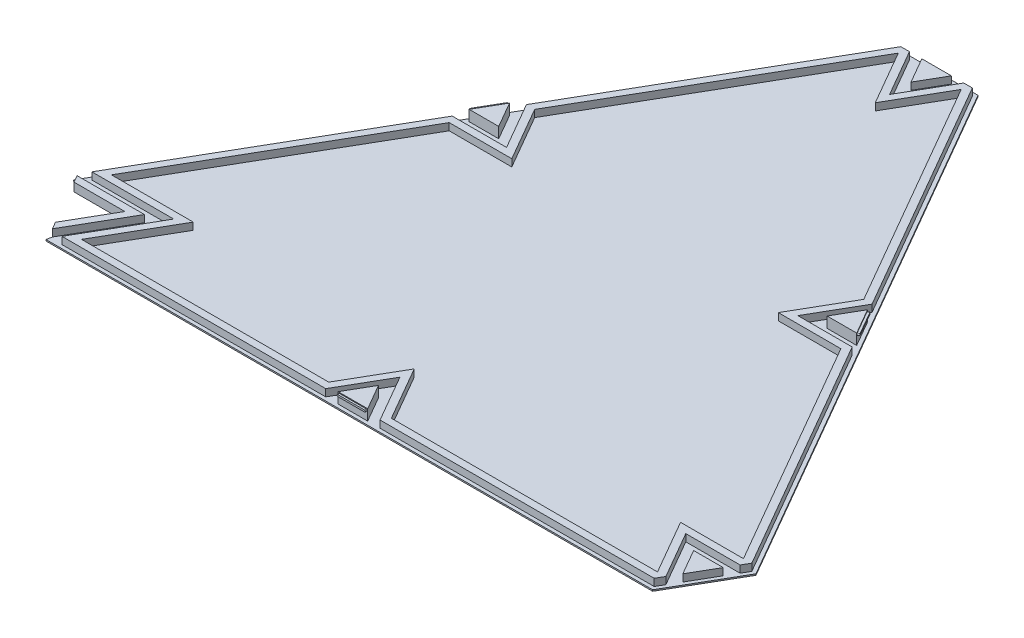
from build123d import *

# Parameters (mm, degrees)
BOSS_EXTRUDE1_DEPTH   = 2.38
BOSS_EXTRUDE1_2_DEPTH = 2.38
BOSS_EXTRUDE1_3_DEPTH = 2.38
BOSS_EXTRUDE1_4_DEPTH = 2.38
BOSS_EXTRUDE4_DEPTH   = 0.38
BOSS_EXTRUDE5_DEPTH   = 3.38
BOSS_EXTRUDE6_DEPTH   = 0.5
BOSS_EXTRUDE7_DEPTH   = 0.6
BOSS_EXTRUDE8_DEPTH   = 0.6


with BuildPart() as part:
    # Sketch1 → Boss-Extrude1 (new body)
    with BuildSketch(Plane(origin=(0, 0, 0), x_dir=(1, 0, 0), z_dir=(0, 1, 0))):
        Polygon((-85.720943795, 4.071796796), (-84.566243256, 2.071796795), (-75.143593538, 18.392304849), (-93.988892974, 18.392304849), (-92.834192436, 16.392304849), (-78.607695153, 16.392304849), align=None)
    extrude(amount=BOSS_EXTRUDE1_DEPTH)


with BuildPart() as body_2:
    # Sketch1 → Boss-Extrude1 2 (new body)
    with BuildSketch(Plane(origin=(0, 0, 0), x_dir=(1, 0, 0), z_dir=(0, 1, 0))):
        Polygon((91.344555444, 13.812177834), (83.076606252, 13.812177834), (87.210580853, 6.651923788), align=None)
    extrude(amount=BOSS_EXTRUDE1_2_DEPTH)


with BuildPart() as body_3:
    # Sketch1 → Boss-Extrude1 3 (new body)
    with BuildSketch(Plane(origin=(0, 0, 0), x_dir=(1, 0, 0), z_dir=(0, 1, 0))):
        Polygon((4.133974596, 164.865334799), (-4.133974596, 164.865334799), (0, 157.705080761), align=None)
    extrude(amount=BOSS_EXTRUDE1_3_DEPTH)


with BuildPart() as body_4:
    # Sketch1 → Boss-Extrude1 4 (new body)
    with BuildSketch(Plane(origin=(0, 0, 0), x_dir=(1, 0, 0), z_dir=(0, 1, 0))):
        Polygon((-92.834192436, 21.392304849), (-69.947441134, 21.392304849), (-81.390816785, 1.571796811), (-7.598076227, 1.571796811), (5.6e-08, 14.732050972), (7.598076338, 1.571796812), (84.27756817, 1.571796812), (85.478530104, 3.651923899), (77.880453952, 16.812177834), (93.076606256, 16.812177834), (94.277568143, 18.892304841), (55.937822181, 85.298692796), (40.741669759, 85.298692796), (48.33974597, 98.458946834), (10.000000007, 164.865334792), (7.598076211, 164.865334792), (0, 151.705080754), (-7.598076212, 164.865334792), (-9.999999977, 164.865334792), (-48.339745938, 98.458946839), (-40.741669726, 85.298692801), (-55.937822149, 85.298692801), align=None)
        Polygon((-8.752776823, 3.571796679), (-77.926715228, 3.571796679), (-66.4833395, 23.392304849), (-89.370090821, 23.392304849), (-54.783121611, 83.298692801), (-37.277568111, 83.298692801), (-46.030344861, 98.458946839), (-8.799038094, 162.945461791), (0, 147.705080754), (8.799038109, 162.945461817), (46.030344894, 98.458946834), (37.277568144, 83.298692796), (54.783121643, 83.298692796), (92.014428415, 18.812177834), (74.416352337, 18.812177834), (83.2153905, 3.571796679), (8.752776819, 3.571796679), (-2e-09, 18.73205084), align=None, mode=Mode.SUBTRACT)
    extrude(amount=BOSS_EXTRUDE1_4_DEPTH)


    add(body_2.part)  # Boss-Extrude4 merges body 2

    add(body_3.part)  # Boss-Extrude4 merges body 3
    # Sketch1<8> → Boss-Extrude4 (add)
    # profile 1 of 2: a face of its own
    with BuildSketch(Plane(origin=(0, 0, 0), x_dir=(1, 0, 0), z_dir=(0, 1, 0))):
        Polygon((-75.143593538, 18.392304849), (-84.566243256, 2.071796795), (-84.854918391, 0.571796796), (84.85491843, 0.571796796), (95.432268703, 18.892304753), (10.577350242, 165.865334799), (-10.577350242, 165.865334799), (-95.432268647, 18.892304849), (-93.988892974, 18.392304849), align=None)
        Polygon((4.133974507, 1.571796687), (-4.133974466, 1.571796687), (-1.08e-07, 8.732050756), align=None, mode=Mode.SUBTRACT)
        Polygon((87.210580853, 6.651923788), (83.076606252, 13.812177834), (91.344555444, 13.812177834), align=None, mode=Mode.SUBTRACT)
        Polygon((-45.937822149, 88.298692801), (-54.205771341, 88.298692801), (-50.071796745, 95.458946839), align=None, mode=Mode.SUBTRACT)
        Polygon((0, 157.705080761), (-4.133974596, 164.865334799), (4.133974596, 164.865334799), align=None, mode=Mode.SUBTRACT)
        Polygon((-81.390816785, 1.571796811), (-69.947441134, 21.392304849), (-92.834192436, 21.392304849), (-55.937822149, 85.298692801), (-40.741669726, 85.298692801), (-48.339745938, 98.458946839), (-9.999999977, 164.865334792), (-7.598076212, 164.865334792), (0, 151.705080754), (7.598076211, 164.865334792), (10.000000007, 164.865334792), (48.33974597, 98.458946834), (40.741669759, 85.298692796), (55.937822181, 85.298692796), (94.277568143, 18.892304841), (93.076606256, 16.812177834), (77.880453952, 16.812177834), (85.478530104, 3.651923899), (84.27756817, 1.571796812), (7.598076338, 1.571796812), (5.6e-08, 14.732050972), (-7.598076227, 1.571796811), align=None, mode=Mode.SUBTRACT)
        Polygon((54.205771446, 88.298692803), (45.937822254, 88.298692803), (50.07179685, 95.458946841), align=None, mode=Mode.SUBTRACT)
    # profile 2 of 2: a face of its own
    with BuildSketch(Plane(origin=(0, 0, 0), x_dir=(1, 0, 0), z_dir=(0, 1, 0))):
        Polygon((-66.4833395, 23.392304849), (-77.926715228, 3.571796679), (-8.752776823, 3.571796679), (-2e-09, 18.73205084), (8.752776819, 3.571796679), (83.2153905, 3.571796679), (74.416352337, 18.812177834), (92.014428415, 18.812177834), (54.783121643, 83.298692796), (37.277568144, 83.298692796), (46.030344894, 98.458946834), (8.799038109, 162.945461817), (0, 147.705080754), (-8.799038094, 162.945461791), (-46.030344861, 98.458946839), (-37.277568111, 83.298692801), (-54.783121611, 83.298692801), (-89.370090821, 23.392304849), align=None)
    extrude(amount=BOSS_EXTRUDE4_DEPTH)

    # Sketch1<9> → Boss-Extrude5 (add)
    with BuildSketch(Plane(origin=(0, 0, 0), x_dir=(1, 0, 0), z_dir=(0, 1, 0))):
        Polygon((-1.08e-07, 8.732050756), (-4.133974466, 1.571796687), (4.133974507, 1.571796687), align=None)
        Polygon((50.07179685, 95.458946841), (45.937822254, 88.298692803), (54.205771446, 88.298692803), align=None)
        Polygon((-50.071796745, 95.458946839), (-54.205771341, 88.298692801), (-45.937822149, 88.298692801), align=None)
    extrude(amount=BOSS_EXTRUDE5_DEPTH)

    # Sketch2 → Boss-Extrude6 (add)
    with BuildSketch(Plane.XY.offset(-1.571796687)):
        with BuildLine():
            Line((3.750000065, 2.63), (-3.749999935, 2.63))
            ThreePointArc((-3.749999935, 2.63), (-3.999999935, 2.88), (-3.749999935, 3.13))
            Line((-3.749999935, 3.13), (3.750000065, 3.13))
            ThreePointArc((3.750000065, 3.13), (4.000000065, 2.88), (3.750000065, 2.63))
        make_face()
    extrude(amount=BOSS_EXTRUDE6_DEPTH)

    # Sketch4 → Boss-Extrude7 (add)
    with BuildSketch(Plane(origin=(-78.888784049, 0, -45.546460707), x_dir=(-0.500000000000003, 0, 0.8660254037844369), z_dir=(-0.8660254037844369, 0, -0.500000000000003))):
        with BuildLine():
            Line((-57.25000001, 3.141925265), (-49.75000001, 3.141925265))
            ThreePointArc((-49.75000001, 3.141925265), (-49.488074744, 2.88), (-49.75000001, 2.618074735))
            Line((-49.75000001, 2.618074735), (-57.25000001, 2.618074735))
            ThreePointArc((-57.25000001, 2.618074735), (-57.511925275, 2.88), (-57.25000001, 3.141925265))
        make_face()
    extrude(amount=BOSS_EXTRUDE7_DEPTH)

    # Sketch5 → Boss-Extrude8 (add)
    with BuildSketch(Plane(origin=(78.888784129, 0, -45.546460753), x_dir=(-0.5000000000000008, 0, -0.8660254037844383), z_dir=(0.8660254037844382, 0, -0.5000000000000007))):
        with BuildLine():
            Line((49.749999961, 3.13), (57.249999961, 3.13))
            ThreePointArc((57.249999961, 3.13), (57.499999961, 2.88), (57.249999961, 2.63))
            Line((57.249999961, 2.63), (49.749999961, 2.63))
            ThreePointArc((49.749999961, 2.63), (49.499999961, 2.88), (49.749999961, 3.13))
        make_face()
    extrude(amount=BOSS_EXTRUDE8_DEPTH)


solid = Compound([part.part, body_4.part])
